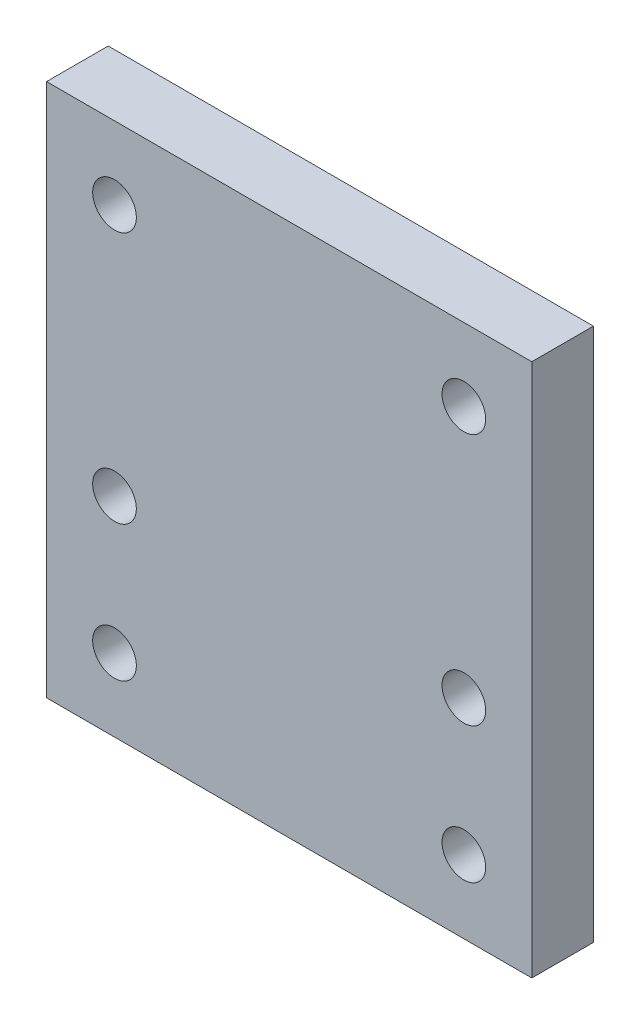
from build123d import *

# Parameters (mm, degrees)
SKETCH1_W           = 100
SKETCH1_H           = 110
BOSS_EXTRUDE1_DEPTH = 12.7
SKETCH2_R           = 4.5
CUT_EXTRUDE1_DEPTH  = 12.7


with BuildPart() as part:
    # Sketch1 → Boss-Extrude1 (new body)
    with BuildSketch(Plane.XY):
        with Locations((50, 55)):
            Rectangle(SKETCH1_W, SKETCH1_H)
    extrude(amount=BOSS_EXTRUDE1_DEPTH)

    # Sketch2 → Cut-Extrude1 (cut)
    with BuildSketch(Plane.XY.offset(12.7)):
        with Locations((86, 15)):
            Circle(SKETCH2_R)
        with Locations((14, 15)):
            Circle(SKETCH2_R)
        with BuildLine():
            ThreePointArc((18.5, 43), (14, 47.5), (9.5, 43))
            ThreePointArc((9.5, 43), (14, 38.5), (18.5, 43))
        make_face()
        with BuildLine():
            ThreePointArc((18.5, 95), (14, 99.5), (9.5, 95))
            ThreePointArc((9.5, 95), (14, 90.5), (18.5, 95))
        make_face()
        with BuildLine():
            ThreePointArc((90.5, 43), (86, 47.5), (81.5, 43))
            ThreePointArc((81.5, 43), (86, 38.5), (90.5, 43))
        make_face()
        with BuildLine():
            ThreePointArc((90.5, 95), (86, 99.5), (81.5, 95))
            ThreePointArc((81.5, 95), (86, 90.5), (90.5, 95))
        make_face()
    extrude(amount=-CUT_EXTRUDE1_DEPTH, mode=Mode.SUBTRACT)


solid = part.part
